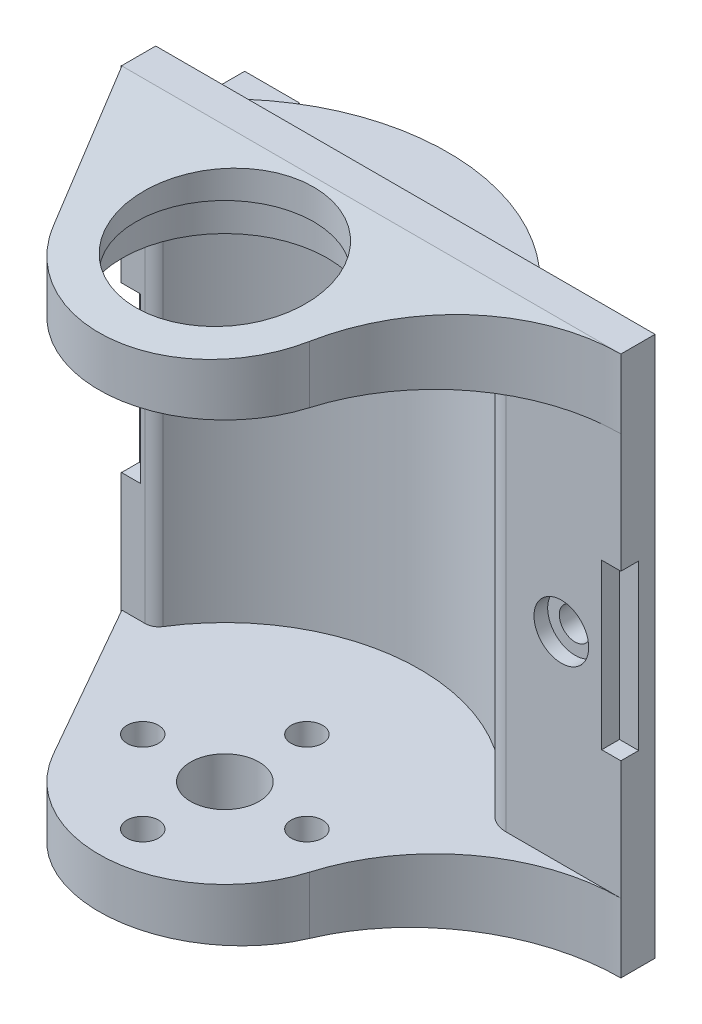
from build123d import *

# Parameters (mm, degrees)
SKETCH_1_R               = 16.3
EXTRUDE_1_DEPTH          = 19.75
SKETCH_2_W               = 36.5
SKETCH_2_H               = 2.5
EXTRUDE_2_DEPTH          = 39.5
SKETCH_3_W               = 44.844436064
SKETCH_3_H               = 25.506740045
CUT_EXTRUDE_1_DEPTH      = 50
EXTRUDE_3_DEPTH          = 5.05
SKETCH_5_R               = 14.25
CUT_EXTRUDE_2_DEPTH      = 29.4
SKETCH_6_R               = 2.5
CUT_EXTRUDE_3_DEPTH      = 44.930797853
CUT_EXTRUDE_6_REACH      = 49.993
SKETCH_9_R               = 7.5
SKETCH_12_R              = 1.15
CUT_EXTRUDE_9_DEPTH      = 34.662664779
SKETCH_13_R              = 2
CUT_EXTRUDE_10_DEPTH     = 1
SKETCH_14_W              = 2.8
SKETCH_14_H              = 12
CUT_EXTRUDE_11_DEPTH     = 1.3
SKETCH_15_W              = 2.8
SKETCH_15_H              = 12
CUT_EXTRUDE_12_DEPTH     = 1.3
EXTRUDE_5_REACH          = 40.183
EXTRUDE_5_END_RADIUS     = 16.3
SKETCH_16_W              = 4
SKETCH_16_H              = 5
SKETCH_17_W              = 1
SKETCH_17_H              = 2
CUT_EXTRUDE_13_DEPTH     = 2.5
SKETCH_19_R              = 8.51898124
SKETCH_19_R_2            = 6.5
EXTRUDE_6_DEPTH          = 2.25
CUT_EXTRUDE_18_REACH     = 49.993
SKETCH_20_R              = 1.15
PATTERN_CIRCULAR_1_COUNT = 4
CUT_EXTRUDE_8_DEPTH      = 45.587021654
SKETCH_18_W              = 26.346157216
SKETCH_18_H              = 2.75
CUT_EXTRUDE_16_DEPTH     = 12.5
FILLET_1_R               = 2
FILLET_2_R               = 1
SKETCH_21_R              = 2.1
CUT_EXTRUDE_19_DEPTH     = 2.5


with BuildPart() as part:
    # 草图1 → 凸台-拉伸1 (new, symmetric)
    with BuildSketch(Plane(origin=(0, 0, 0), x_dir=(1, 0, 0), z_dir=(0, 1, 0))):
        with Locations(Location((0, 0, 0), (0, 0, 270))):
            Circle(SKETCH_1_R)
    extrude(amount=EXTRUDE_1_DEPTH, both=True)

    # 草图2 → 凸台-拉伸2 (add, through all)
    with BuildSketch(Plane.XZ.offset(19.75)):
        with Locations((3.6, -8.35)):
            Rectangle(SKETCH_2_W, SKETCH_2_H)
    extrude(amount=-EXTRUDE_2_DEPTH)

    # 草图3 → 切除-拉伸1 (cut)
    with BuildSketch(Plane.XZ.offset(19.75)):
        with Locations((-0.572218032, 5.653370022)):
            Rectangle(SKETCH_3_W, SKETCH_3_H)
    extrude(amount=-CUT_EXTRUDE_1_DEPTH, mode=Mode.SUBTRACT)

    # 草图4 → 凸台-拉伸3 (add)
    with BuildSketch(Plane.XZ.offset(19.75)):
        with BuildLine():
            Line((-14.65, -7.146152811), (-7.996542478, 4.549209646))
            ThreePointArc((-7.996542478, 4.549209646), (1.047927533, 9.140122969), (8.818653972, 2.621324497))
            ThreePointArc((8.818653972, 2.621324497), (13.721037439, -4.401937543), (21.85, -7.1))
            Line((21.85, -7.1), (-14.65, -7.146152811))
        make_face()
    extrude_3 = extrude(amount=-EXTRUDE_3_DEPTH)

    # 镜向1: 凸台-拉伸3 across plane
    add(extrude_3.mirror(Plane.ZX))

    # 草图5 → 切除-拉伸2 (cut)
    with BuildSketch(Plane(origin=(0, -14.7, 0), x_dir=(1, 0, 0), z_dir=(0, 1, 0))):
        Circle(SKETCH_5_R)
    extrude(amount=CUT_EXTRUDE_2_DEPTH, mode=Mode.SUBTRACT)

    # 草图6 → 切除-拉伸3 (cut, through all)
    with BuildSketch(Plane(origin=(0, -14.7, 0), x_dir=(1, 0, 0), z_dir=(0, 1, 0))):
        with Locations(Location((0, 0, 0), (0, 0, 270))):
            Circle(SKETCH_6_R)
    extrude(amount=-CUT_EXTRUDE_3_DEPTH, mode=Mode.SUBTRACT)

    # 草图9 → 切除-拉伸6 (cut, up to next)
    with BuildSketch(Plane(origin=(0, 19.75, 0), x_dir=(1, 0, 0), z_dir=(0, 1, 0)), mode=Mode.PRIVATE) as cut_extrude_6_sk1:
        with Locations(Location((0, 0, 0), (0, 0, 270))):
            Circle(SKETCH_9_R)
    cut_extrude_6_tool1 = extrude(cut_extrude_6_sk1.sketch, amount=-CUT_EXTRUDE_6_REACH, mode=Mode.PRIVATE) & part.part
    add(cut_extrude_6_tool1.solids().sort_by_distance((0, 19.75, 0))[0], mode=Mode.SUBTRACT)

    # 草图12 → 切除-拉伸9 (cut, through all)
    with BuildSketch(Plane.XY.offset(-7.1)):
        with Locations((17.5, 0)):
            Circle(SKETCH_12_R)
    extrude(amount=-CUT_EXTRUDE_9_DEPTH, mode=Mode.SUBTRACT)

    # 草图13 → 切除-拉伸10 (cut)
    with BuildSketch(Plane.XY.offset(-7.1)):
        with Locations((17.5, 0)):
            Circle(SKETCH_13_R)
    extrude(amount=-CUT_EXTRUDE_10_DEPTH, mode=Mode.SUBTRACT)

    # 草图14 → 切除-拉伸11 (cut)
    with BuildSketch(Plane.XY.offset(-7.1)):
        with Locations((21.85, 0)):
            Rectangle(SKETCH_14_W, SKETCH_14_H)
    extrude(amount=-CUT_EXTRUDE_11_DEPTH, mode=Mode.SUBTRACT)

    # 草图15 → 切除-拉伸12 (cut)
    with BuildSketch(Plane.XY.offset(-7.1)):
        with Locations((-14.672423113, 0)):
            Rectangle(SKETCH_15_W, SKETCH_15_H)
    extrude(amount=-CUT_EXTRUDE_12_DEPTH, mode=Mode.SUBTRACT)

    # 凸台-拉伸5: up to this cylinder (the profile starts outside it)
    extrude_5_end = Plane(origin=(0, 13.4, 0), z_dir=(0, -1, 0)) * Cylinder(EXTRUDE_5_END_RADIUS, 113.966, mode=Mode.PRIVATE)
    # 草图16 → 凸台-拉伸5 (add, up to the surface)
    with BuildSketch(Plane(origin=(0, 0, -15.1), x_dir=(-1, 0, 0), z_dir=(0, 0, -1)), mode=Mode.PRIVATE) as extrude_5_sk1:
        with Locations((11.65, 13.4)):
            Rectangle(SKETCH_16_W, SKETCH_16_H)
    extrude_5_tool1 = extrude(extrude_5_sk1.sketch, amount=-EXTRUDE_5_REACH, mode=Mode.PRIVATE) - extrude_5_end
    extrude_5 = extrude_5_tool1.solids().sort_by_distance((-11.65, 13.4, -15.1))[0]
    add(extrude_5)

    # 镜向4: 凸台-拉伸5 across plane
    add(extrude_5.mirror(Plane.ZX))

    # 草图17 → 切除-拉伸13 (cut)
    with BuildSketch(Plane(origin=(0, 0, -15.1), x_dir=(-1, 0, 0), z_dir=(0, 0, -1))):
        with Locations((11.65, 13.4)):
            Rectangle(SKETCH_17_W, SKETCH_17_H)
    cut_extrude_13 = extrude(amount=-CUT_EXTRUDE_13_DEPTH, mode=Mode.SUBTRACT)

    # 镜向5: 切除-拉伸13 across plane
    add(cut_extrude_13.mirror(Plane.ZX), mode=Mode.SUBTRACT)

    # 草图19 → 凸台-拉伸6 (add)
    with BuildSketch(Plane(origin=(0, 19.75, 0), x_dir=(1, 0, 0), z_dir=(0, 1, 0))):
        Circle(SKETCH_19_R)
        with Locations(Location((0, 0, 0), (0, 0, 270))):
            Circle(SKETCH_19_R_2, mode=Mode.SUBTRACT)
    extrude(amount=-EXTRUDE_6_DEPTH)

    # 草图20 → 切除-拉伸18 (cut, up to next)
    with BuildSketch(Plane.XZ.offset(19.75), mode=Mode.PRIVATE) as cut_extrude_18_sk1:
        with Locations(Location((0, 6, 0), (0, 0, 270))):
            Circle(SKETCH_20_R)
    cut_extrude_18_tool1 = extrude(cut_extrude_18_sk1.sketch, amount=-CUT_EXTRUDE_18_REACH, mode=Mode.PRIVATE) & part.part
    cut_extrude_18 = cut_extrude_18_tool1.solids().sort_by_distance((0, -19.75, 6))[0]
    add(cut_extrude_18, mode=Mode.SUBTRACT)

    # 阵列(圆周)1: 切除-拉伸18 ×4 about axis
    pattern_circular_1_axis = Axis((0, 0, 0), (0, 1, 0))
    for i in range(1, PATTERN_CIRCULAR_1_COUNT):
        add(cut_extrude_18.rotate(pattern_circular_1_axis, i * 360 / PATTERN_CIRCULAR_1_COUNT), mode=Mode.SUBTRACT)

    # 草图7 → 切除-拉伸8 (cut, through all)
    with BuildSketch(Plane.ZY.offset(14.65)):
        Polygon((-7.1, 19.75), (9.2, 18.323934785), (9.2, 19.75), align=None)
    cut_extrude_8 = extrude(amount=-CUT_EXTRUDE_8_DEPTH, mode=Mode.SUBTRACT)

    # 镜向3: 切除-拉伸8 across plane
    add(cut_extrude_8.mirror(Plane.ZX), mode=Mode.SUBTRACT)

    # 草图18 → 切除-拉伸16 (cut)
    with BuildSketch(Plane(origin=(0, 0, -9.6), x_dir=(-1, 0, 0), z_dir=(0, 0, -1))):
        with Locations((0, 18.375)):
            Rectangle(SKETCH_18_W, SKETCH_18_H)
    cut_extrude_16 = extrude(amount=CUT_EXTRUDE_16_DEPTH, mode=Mode.SUBTRACT)

    # 镜向6: 切除-拉伸16 across plane
    add(cut_extrude_16.mirror(Plane.ZX), mode=Mode.SUBTRACT)

    # 圆角1
    fillet_1_edges = [part.edges().sort_by_distance(p)[0] for p in [
        (12.355262037, 0, -7.1),
    ]]
    fillet(fillet_1_edges, radius=FILLET_1_R)

    # 圆角2
    fillet_2_edges = [part.edges().sort_by_distance(p)[0] for p in [
        (-12.355262037, 0, -7.1),
    ]]
    fillet(fillet_2_edges, radius=FILLET_2_R)

    # 草图21 → 切除-拉伸19 (cut)
    with BuildSketch(Plane.XZ.offset(19.75)):
        with Locations(Location((0, 6, 0), (0, 0, 270))):
            Circle(SKETCH_21_R)
        with Locations(Location((-6, 0, 0), (0, 0, 270))):
            Circle(SKETCH_21_R)
        with Locations(Location((6, 0, 0), (0, 0, 270))):
            Circle(SKETCH_21_R)
        with Locations(Location((0, -6, 0), (0, 0, 270))):
            Circle(SKETCH_21_R)
    extrude(amount=-CUT_EXTRUDE_19_DEPTH, mode=Mode.SUBTRACT)


solid = part.part
